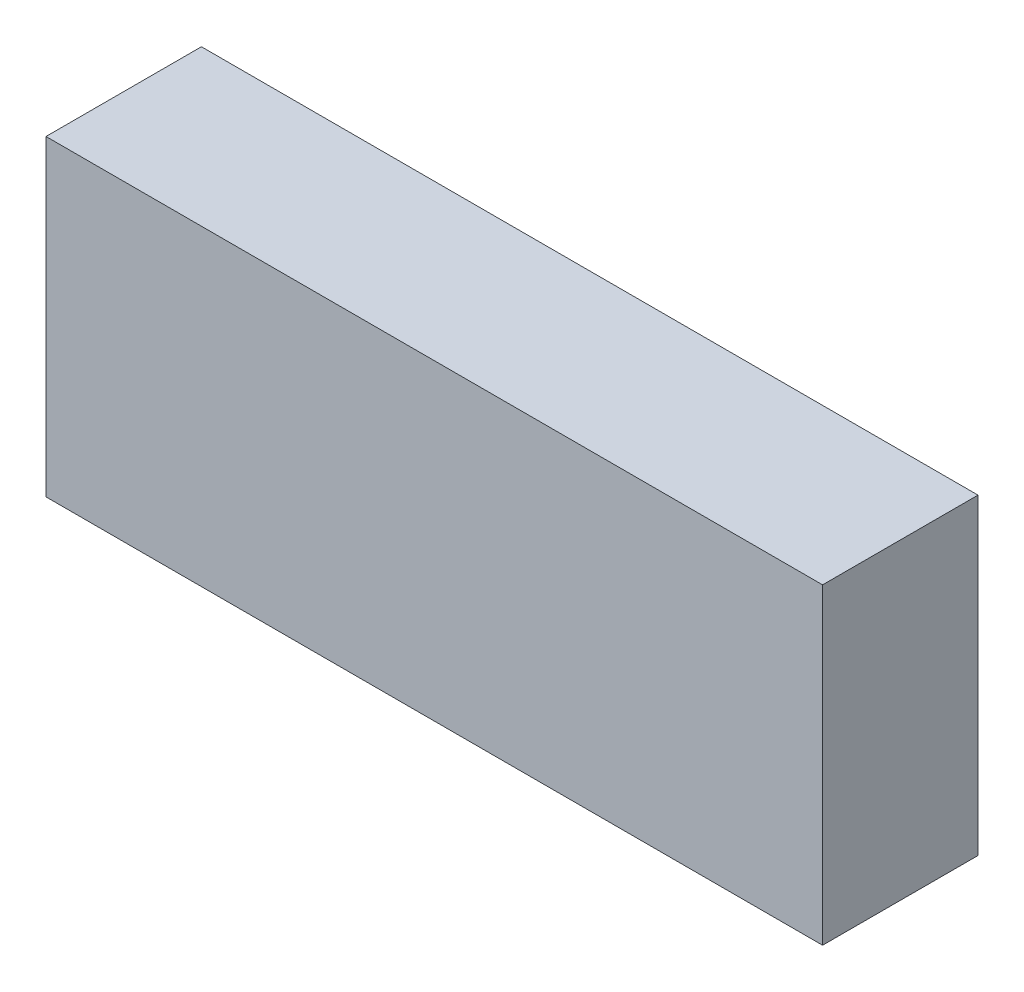
from build123d import *

# Parameters (mm, degrees)
SKETCH1_W               = 4.9968
SKETCH1_H               = 2.0084
COMPONENT_OUTLINE_DEPTH = 1


with BuildPart() as part:
    # Sketch1 → Component_Outline (new body)
    with BuildSketch(Plane.XY):
        with Locations((0, 0.0042)):
            Rectangle(SKETCH1_W, SKETCH1_H)
    extrude(amount=COMPONENT_OUTLINE_DEPTH)


solid = part.part
